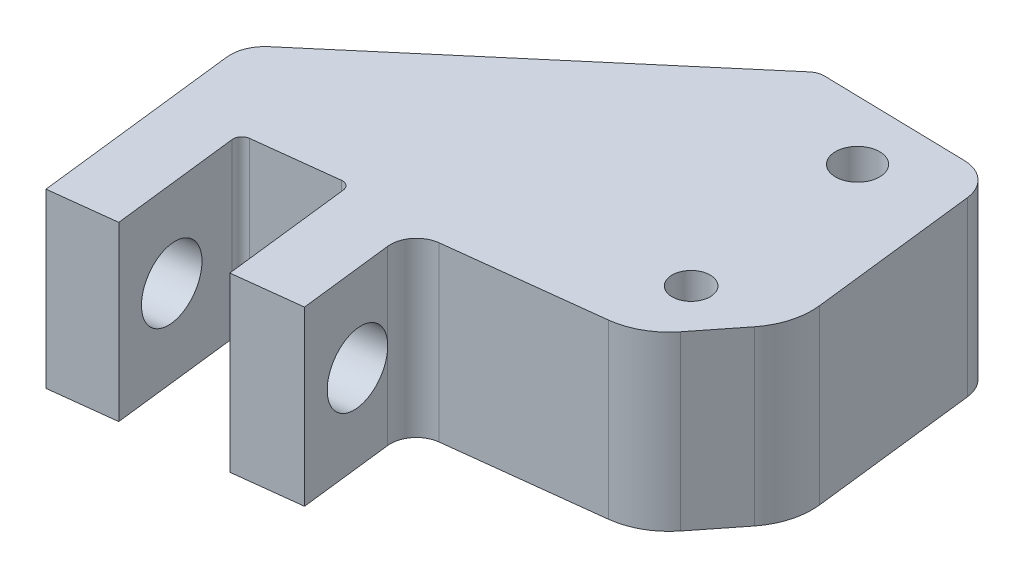
from build123d import *

# Parameters (mm, degrees)
SKETCH1_R           = 1.1
SKETCH1_R_2         = 1.275
BOSS_EXTRUDE1_DEPTH = 10
CUT_EXTRUDE1_REACH  = 26.248
SKETCH2_R           = 2


with BuildPart() as part:
    # Sketch1 → Boss-Extrude1 (new body)
    with BuildSketch(Plane(origin=(0, 0, 0), x_dir=(1, 0, 0), z_dir=(0, 1, 0))):
        with BuildLine():
            Line((-0.14574984, -11.884940884), (-0.786390008, -6.422379198))
            ThreePointArc((-0.786390008, -6.422379198), (-0.47358648, -5.317764588), (0.528679497, -4.757869602))
            Line((0.528679497, -4.757869602), (9.311630254, -3.727819716))
            ThreePointArc((9.311630254, -3.727819716), (10.796478274, -3.247110532), (11.984339527, -2.23476642))
            Line((11.984339527, -2.23476642), (13.875281694, 0.158636645))
            ThreePointArc((13.875281694, 0.158636645), (14.585315074, 1.548495472), (14.709424435, 3.104275606))
            Line((14.709424435, 3.104275606), (13.5695918, 12.82331353))
            ThreePointArc((13.5695918, 12.82331353), (12.929514776, 14.069357174), (11.628964331, 14.589829938))
            Line((11.628964331, 14.589829938), (3.343384407, 14.779447839))
            ThreePointArc((3.343384407, 14.779447839), (2.986138405, 14.722152658), (2.672663493, 14.541484665))
            Line((2.672663493, 14.541484665), (-14.252716913, 0.147516765))
            ThreePointArc((-14.252716913, 0.147516765), (-14.818303875, -0.644136315), (-14.943419752, -1.608993417))
            Line((-14.943419752, -1.608993417), (-13.553855797, -13.457421295))
            Line((-13.553855797, -13.457421295), (-9.779722269, -13.01479718))
            Line((-9.779722269, -13.01479718), (-10.653322497, -5.565849426))
            ThreePointArc((-10.653322497, -5.565849426), (-10.549054654, -5.197644556), (-10.214965995, -5.011012894))
            Line((-10.214965995, -5.011012894), (-5.447639433, -4.451908747))
            ThreePointArc((-5.447639433, -4.451908747), (-5.079434563, -4.55617659), (-4.892802901, -4.890265249))
            Line((-4.892802901, -4.890265249), (-4.019202672, -12.339213003))
            Line((-4.019202672, -12.339213003), (-0.14574984, -11.884940884))
        make_face()
        with Locations(Location((9.994689714, 0.379702838, 0), (0, 0, 270))):
            Circle(SKETCH1_R, mode=Mode.SUBTRACT)
        with Locations(Location((8.71340938, 11.304826211, 0), (0, 0, 270))):
            Circle(SKETCH1_R_2, mode=Mode.SUBTRACT)
    extrude(amount=BOSS_EXTRUDE1_DEPTH)

    # Cut-Extrude1: up to this face of the body (flat: up to its plane)
    cut_extrude1_end = Plane(part.part.faces().sort_by_distance((-14.248637775, 5, 7.533207356))[0])
    # Sketch2 → Cut-Extrude1 (cut, up to the picked face)
    with BuildSketch(Plane(origin=(-1.518707361, 0, 0.178111478), x_dir=(-0.11648003043562742, 0, -0.9931930338608479), z_dir=(0.993193033860848, 0, -0.11648003043562744)), mode=Mode.PRIVATE) as cut_extrude1_sk1:
        with Locations((-8.287063548, 5)):
            Circle(SKETCH2_R)
    cut_extrude1_tool1 = split(extrude(cut_extrude1_sk1.sketch, amount=-CUT_EXTRUDE1_REACH, mode=Mode.PRIVATE), bisect_by=cut_extrude1_end, keep=Keep.BOTH, mode=Mode.PRIVATE)
    add(cut_extrude1_tool1.solids().sort_by(Axis((-0.55343, 5, 8.408765), (-0.993193033860848, 0, 0.11648003043562744)))[0], mode=Mode.SUBTRACT)


solid = part.part
